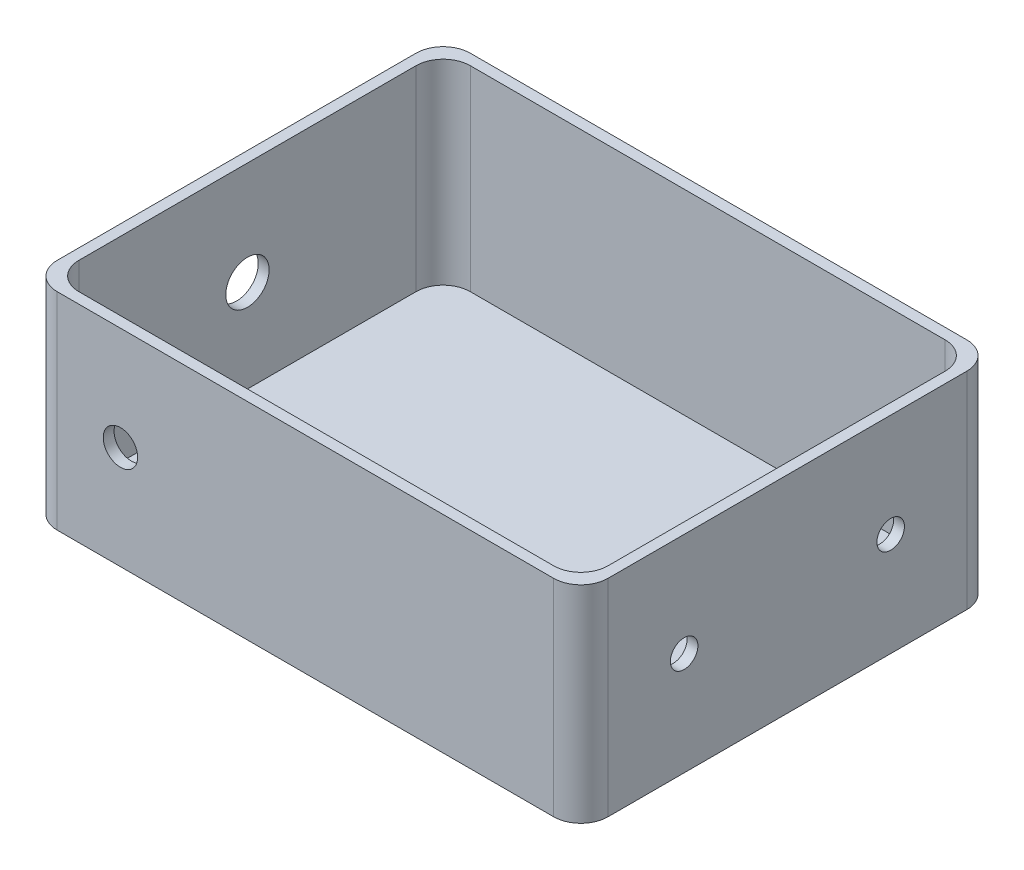
from build123d import *

# Parameters (mm, degrees)
SKETCH1_W           = 101.6
SKETCH1_H           = 76.2
BOSS_EXTRUDE1_DEPTH = 38.1
SKETCH3_W           = 97.6
SKETCH3_H           = 72.2
CUT_EXTRUDE1_DEPTH  = 36.1
SKETCH7_R           = 2.54
CUT_EXTRUDE2_DEPTH  = 2
SKETCH9_R           = 4
CUT_EXTRUDE3_DEPTH  = 2
SKETCH11_R          = 3.175
CUT_EXTRUDE4_DEPTH  = 2
FILLET1_R           = 5
FILLET2_R           = 5
CUT_EXTRUDE5_DEPTH  = 1


with BuildPart() as part:
    # Sketch1 → Boss-Extrude1 (new body)
    with BuildSketch(Plane(origin=(0, 0, 0), x_dir=(1, 0, 0), z_dir=(0, 1, 0))):
        Rectangle(SKETCH1_W, SKETCH1_H)
    extrude(amount=BOSS_EXTRUDE1_DEPTH)

    # Sketch3 → Cut-Extrude1 (cut)
    with BuildSketch(Plane(origin=(0, 38.1, 0), x_dir=(1, 0, 0), z_dir=(0, 1, 0))):
        Rectangle(SKETCH3_W, SKETCH3_H)
    extrude(amount=-CUT_EXTRUDE1_DEPTH, mode=Mode.SUBTRACT)

    # Sketch7 → Cut-Extrude2 (cut)
    with BuildSketch(Plane(origin=(50.8, 0, 0), x_dir=(0, 0, -1), z_dir=(1, 0, 0))):
        with Locations((-19.05, 19.05)):
            Circle(SKETCH7_R)
        with Locations((19.05, 19.05)):
            Circle(SKETCH7_R)
    extrude(amount=-CUT_EXTRUDE2_DEPTH, mode=Mode.SUBTRACT)

    # Sketch9 → Cut-Extrude3 (cut)
    with BuildSketch(Plane.ZY.offset(50.8)):
        with Locations((0, 19.05)):
            Circle(SKETCH9_R)
    extrude(amount=-CUT_EXTRUDE3_DEPTH, mode=Mode.SUBTRACT)

    # Sketch11 → Cut-Extrude4 (cut)
    with BuildSketch(Plane.XY.offset(38.1)):
        with Locations((-34.127797524, 19.05)):
            Circle(SKETCH11_R)
    extrude(amount=-CUT_EXTRUDE4_DEPTH, mode=Mode.SUBTRACT)

    # Fillet1
    fillet1_edges = [part.edges().sort_by_distance(p)[0] for p in [
        (50.8, 19.05, 38.1),
        (-50.8, 19.05, 38.1),
        (-50.8, 19.05, -38.1),
        (50.8, 19.05, -38.1),
    ]]
    fillet(fillet1_edges, radius=FILLET1_R)

    # Fillet2
    fillet2_edges = [part.edges().sort_by_distance(p)[0] for p in [
        (48.8, 20.05, 36.1),
        (-48.8, 20.05, 36.1),
        (-48.8, 20.05, -36.1),
        (48.8, 20.05, -36.1),
    ]]
    fillet(fillet2_edges, radius=FILLET2_R)

    # Sketch12 → Cut-Extrude5 (cut)
    # profile 1 of 2: a face of its own
    with BuildSketch(Plane.XZ):
        Polygon((-16.893847177, 6.052120704), (-32.260033074, 6.052120704), (-24.77410559, 22.334171986), (-24.386134837, 22.334171986), align=None)
        Polygon((-19.09446817, 7.476800191), (-24.576940125, 19.395770544), (-30.056231992, 7.476800191), align=None, mode=Mode.SUBTRACT)
    # profile 2 of 2: a face of its own
    with BuildSketch(Plane.XZ):
        Polygon((-6.564920895, 6.052120704), (-15.774456151, 6.052120704), (-11.338233194, 14.110464053), (-15.774456151, 21.927120704), (-6.768446536, 21.927120704), (-6.768446536, 20.298915576), (-13.255826343, 20.298915576), (-9.61780551, 13.887857884), (-13.144523258, 7.476800191), (-6.564920895, 7.476800191), align=None)
    extrude(amount=-CUT_EXTRUDE5_DEPTH, mode=Mode.SUBTRACT)


solid = part.part
